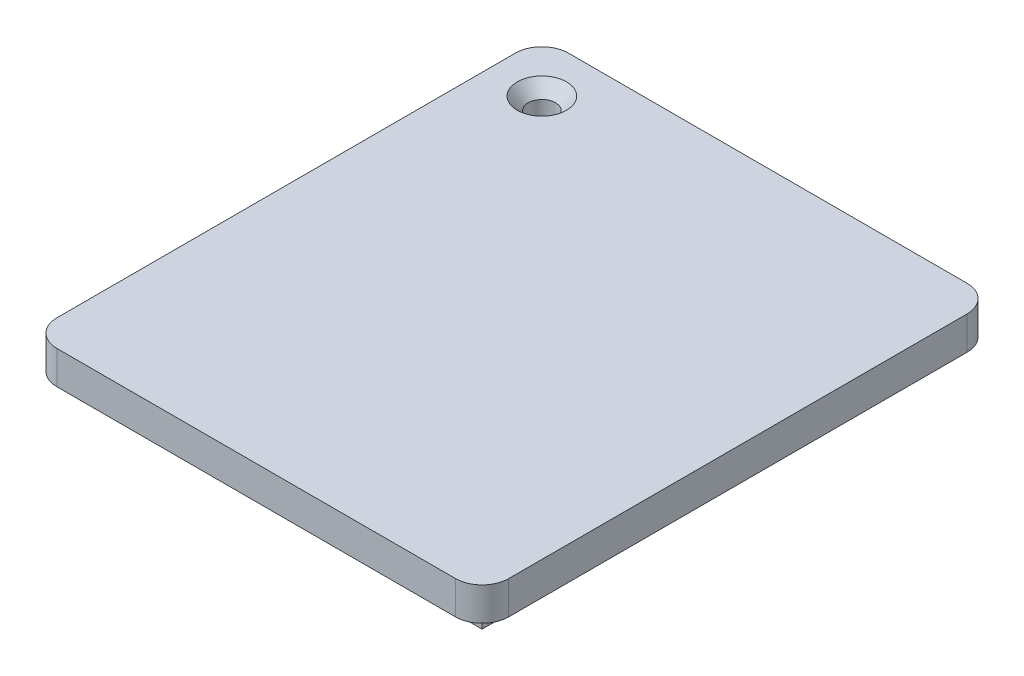
from build123d import *

# Parameters (mm, degrees)
SKETCH1_W                                      = 34
SKETCH1_H                                      = 2.5
EXTRUDE1_DEPTH                                 = 38.5
FILLET1_R                                      = 2
SKETCH2_W                                      = 31.6
SKETCH2_H                                      = 36.1
EXTRUDE2_DEPTH                                 = 1
CSK_FOR_1_FLAT_HEAD_MACHINE_SCREW1_D           = 2.0574
CSK_FOR_1_FLAT_HEAD_MACHINE_SCREW1_CSINK_D     = 3.7084
CSK_FOR_1_FLAT_HEAD_MACHINE_SCREW1_CSINK_ANGLE = 82


with BuildPart() as part:
    # Sketch1 → Extrude1 (new body)
    with BuildSketch(Plane.XY):
        with Locations((-7.05, 3.25)):
            Rectangle(SKETCH1_W, SKETCH1_H)
    extrude(amount=-EXTRUDE1_DEPTH)

    # Fillet1
    fillet1_edges = [part.edges().sort_by_distance(p)[0] for p in [
        (9.95, 3.25, -38.5),
        (9.95, 3.25, 0),
        (-24.05, 3.25, 0),
        (-24.05, 3.25, -38.5),
    ]]
    fillet(fillet1_edges, radius=FILLET1_R)

    # Sketch2 → Extrude2 (add)
    with BuildSketch(Plane.XZ.offset(-2)):
        with Locations((-7.05, -19.25)):
            Rectangle(SKETCH2_W, SKETCH2_H)
    extrude(amount=EXTRUDE2_DEPTH)

    # CSK for #1 Flat Head Machine Screw1 (through all)
    with Locations(Plane(origin=(-20.25, 4.5, -34.7), x_dir=(0, 0, 1), z_dir=(0, 1, 0))):
        with Locations((0, 0)):
            CounterSinkHole(CSK_FOR_1_FLAT_HEAD_MACHINE_SCREW1_D / 2, CSK_FOR_1_FLAT_HEAD_MACHINE_SCREW1_CSINK_D / 2, counter_sink_angle=CSK_FOR_1_FLAT_HEAD_MACHINE_SCREW1_CSINK_ANGLE)


solid = part.part
